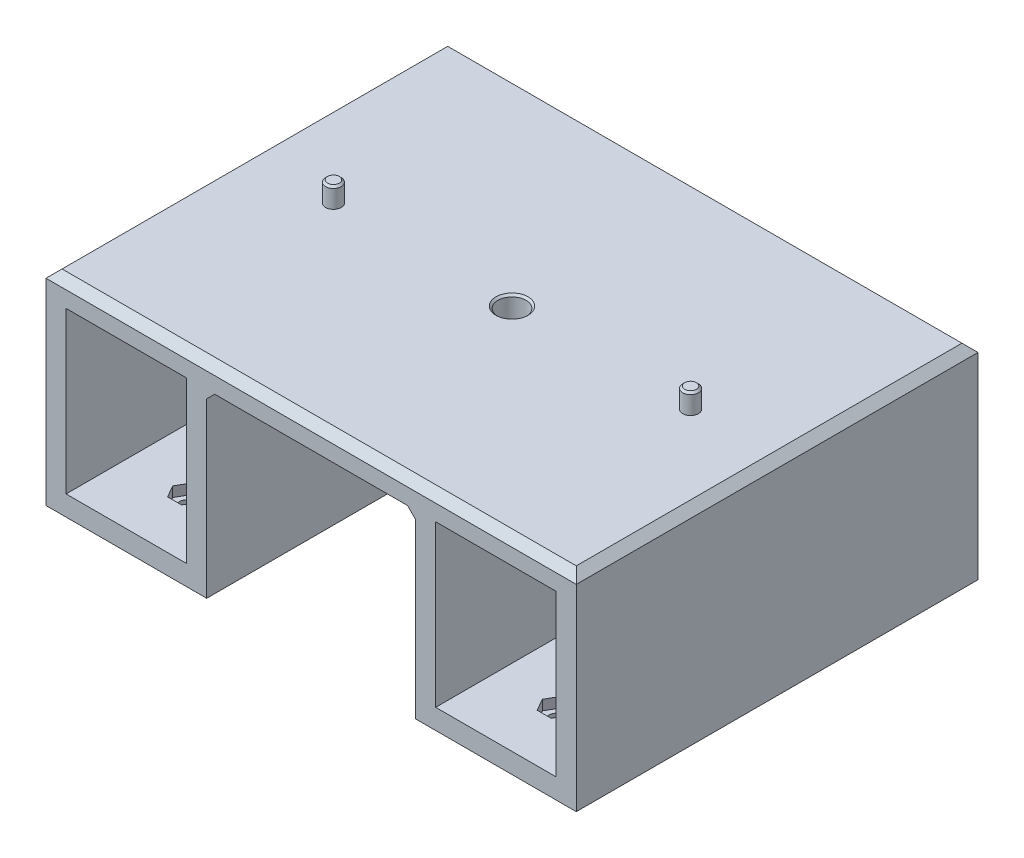
from build123d import *

# Parameters (mm, degrees)
EXTRUDE_1_DEPTH     = 50
SKETCH_2_R          = 3.5
CUT_EXTRUDE_1_DEPTH = 98.247107926
SKETCH_3_R          = 1.95
EXTRUDE_2_DEPTH     = 5
CUT_EXTRUDE_2_REACH = 101.96
SKETCH_4_R          = 1.75
CHAMFER_1_SIZE      = 2
CHAMFER_2_SIZE      = 2
CHAMFER_3_SIZE      = 0.5
CUT_EXTRUDE_3_DEPTH = 2.5


with BuildPart() as part:
    # 草图1 → 凸台-拉伸1 (new, symmetric)
    with BuildSketch(Plane.XY):
        Polygon((-26, 45), (0, 45), (0, 49.079214745), (0, 51), (-60, 51), (-66, 51), (-66, 5), (-66, 0), (-55, 0), (-26, 0), align=None)
        Polygon((-31, 5), (-61, 5), (-61, 45), (-55, 45), (-31, 45), align=None, mode=Mode.SUBTRACT)
    extrude_1 = extrude(amount=EXTRUDE_1_DEPTH, both=True)

    # 镜向1: 凸台-拉伸1 across plane
    add(extrude_1.mirror(Plane(origin=(0, 0, 50), x_dir=(0, 0, 1), z_dir=(1, 0, 0))))

    # 草图2 → 切除-拉伸1 (cut, through all)
    with BuildSketch(Plane(origin=(0, 51, 0), x_dir=(1, 0, 0), z_dir=(0, 1, 0))):
        with Locations(Location((0, 0, 0), (0, 0, 270))):
            Circle(SKETCH_2_R)
    extrude(amount=-CUT_EXTRUDE_1_DEPTH, mode=Mode.SUBTRACT)

    # 草图3 → 凸台-拉伸2 (add)
    with BuildSketch(Plane(origin=(0, 51, 0), x_dir=(1, 0, 0), z_dir=(0, 1, 0))):
        with Locations(Location((44.45, 0, 0), (0, 0, 270))):
            Circle(SKETCH_3_R)
        with Locations(Location((-44.45, 0, 0), (0, 0, 90))):
            Circle(SKETCH_3_R)
    extrude(amount=EXTRUDE_2_DEPTH)

    # 草图4 → 切除-拉伸2 (cut, up to next)
    with BuildSketch(Plane.XZ, mode=Mode.PRIVATE) as cut_extrude_2_sk1:
        with Locations((-46, 35)):
            Circle(SKETCH_4_R)
    cut_extrude_2_tool1 = extrude(cut_extrude_2_sk1.sketch, amount=-CUT_EXTRUDE_2_REACH, mode=Mode.PRIVATE) & part.part
    # 草图4 → 切除-拉伸2 (cut, up to next)
    with BuildSketch(Plane.XZ, mode=Mode.PRIVATE) as cut_extrude_2_sk2:
        with Locations((46, 35)):
            Circle(SKETCH_4_R)
    cut_extrude_2_tool2 = extrude(cut_extrude_2_sk2.sketch, amount=-CUT_EXTRUDE_2_REACH, mode=Mode.PRIVATE) & part.part
    # 草图4 → 切除-拉伸2 (cut, up to next)
    with BuildSketch(Plane.XZ, mode=Mode.PRIVATE) as cut_extrude_2_sk3:
        with Locations((46, -35)):
            Circle(SKETCH_4_R)
    cut_extrude_2_tool3 = extrude(cut_extrude_2_sk3.sketch, amount=-CUT_EXTRUDE_2_REACH, mode=Mode.PRIVATE) & part.part
    # 草图4 → 切除-拉伸2 (cut, up to next)
    with BuildSketch(Plane.XZ, mode=Mode.PRIVATE) as cut_extrude_2_sk4:
        with Locations((-46, -35)):
            Circle(SKETCH_4_R)
    cut_extrude_2_tool4 = extrude(cut_extrude_2_sk4.sketch, amount=-CUT_EXTRUDE_2_REACH, mode=Mode.PRIVATE) & part.part
    add(cut_extrude_2_tool1.solids().sort_by_distance((-46, 0, 35))[0], mode=Mode.SUBTRACT)
    add(cut_extrude_2_tool2.solids().sort_by_distance((46, 0, 35))[0], mode=Mode.SUBTRACT)
    add(cut_extrude_2_tool3.solids().sort_by_distance((46, 0, -35))[0], mode=Mode.SUBTRACT)
    add(cut_extrude_2_tool4.solids().sort_by_distance((-46, 0, -35))[0], mode=Mode.SUBTRACT)

    # 倒角1
    chamfer_1_edges = [part.edges().sort_by_distance(p)[0] for p in [
        (-26, 45, 0),
        (26, 45, 0),
    ]]
    chamfer(chamfer_1_edges, length=CHAMFER_1_SIZE)

    # 倒角2
    chamfer_2_edges = [part.edges().sort_by_distance(p)[0] for p in [
        (0, 51, -50),
        (-66, 51, 0),
        (66, 51, 0),
        (0, 51, 50),
    ]]
    chamfer(chamfer_2_edges, length=CHAMFER_2_SIZE)

    # 倒角3
    chamfer_3_edges = [part.edges().sort_by_distance(p)[0] for p in [
        (0, 51, -3.5),
        (44.45, 56, -1.95),
        (-44.45, 56, 1.95),
    ]]
    chamfer(chamfer_3_edges, length=CHAMFER_3_SIZE)

    # 草图6 → 切除-拉伸3 (cut)
    with BuildSketch(Plane(origin=(0, 5, 0), x_dir=(1, 0, 0), z_dir=(0, 1, 0))):
        Polygon((42.535898385, 35), (44.267949192, 32), (47.732050808, 32), (49.464101615, 35), (47.732050808, 38), (44.267949192, 38), align=None)
        Polygon((-47.732050808, 32), (-44.267949192, 32), (-42.535898385, 35), (-44.267949192, 38), (-47.732050808, 38), (-49.464101615, 35), align=None)
        Polygon((-47.732050808, -38), (-44.267949192, -38), (-42.535898385, -35), (-44.267949192, -32), (-47.732050808, -32), (-49.464101615, -35), align=None)
        Polygon((42.535898385, -35), (44.267949192, -38), (47.732050808, -38), (49.464101615, -35), (47.732050808, -32), (44.267949192, -32), align=None)
    extrude(amount=-CUT_EXTRUDE_3_DEPTH, mode=Mode.SUBTRACT)


solid = part.part
